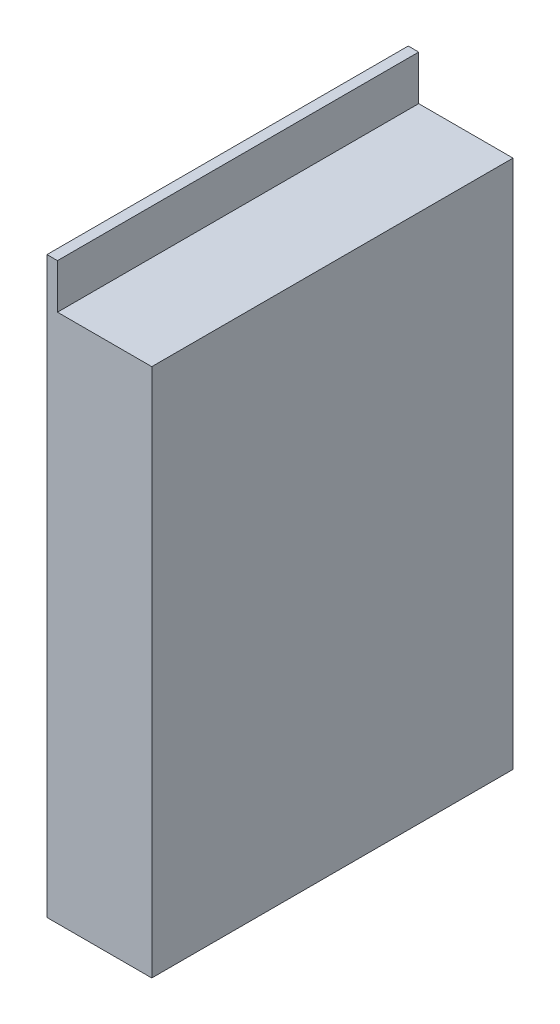
from build123d import *

# Parameters (mm, degrees)
SKETCH2_W           = 65.5
SKETCH2_H           = 96
BOSS_EXTRUDE1_DEPTH = 19
SKETCH3_W           = 1.9
SKETCH3_H           = 65.5
BOSS_EXTRUDE2_DEPTH = 8.1


with BuildPart() as part:
    # Sketch2 → Boss-Extrude1 (new body)
    with BuildSketch(Plane(origin=(0, 0, 0), x_dir=(0, 0, -1), z_dir=(1, 0, 0))):
        with Locations((32.75, 48)):
            Rectangle(SKETCH2_W, SKETCH2_H)
    extrude(amount=BOSS_EXTRUDE1_DEPTH)

    # Sketch3 → Boss-Extrude2 (add)
    with BuildSketch(Plane(origin=(0, 96, 0), x_dir=(1, 0, 0), z_dir=(0, 1, 0))):
        with Locations((0.95, 32.75)):
            Rectangle(SKETCH3_W, SKETCH3_H)
    extrude(amount=BOSS_EXTRUDE2_DEPTH)


solid = part.part
